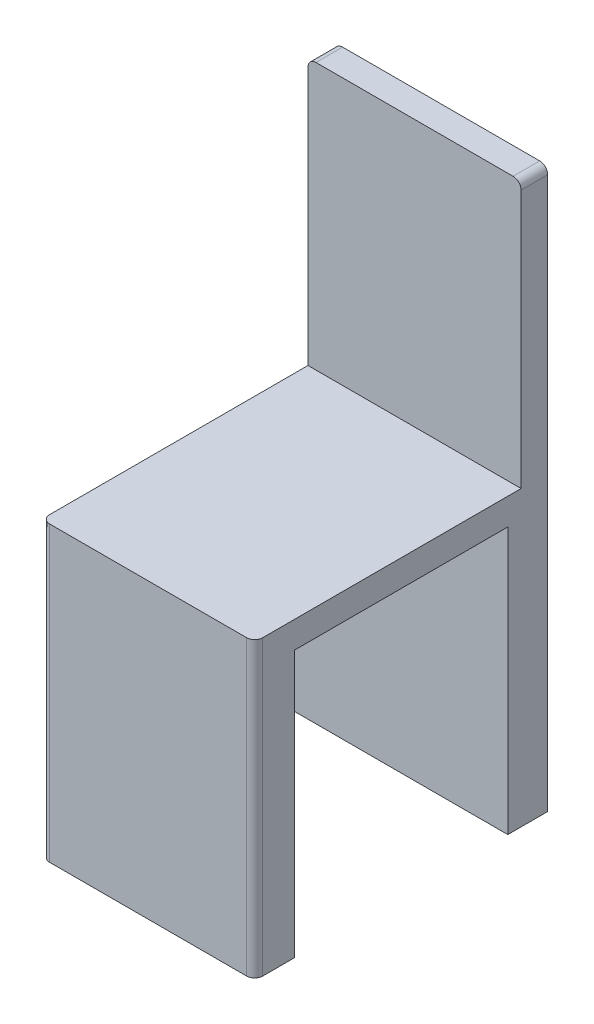
from build123d import *

# Parameters (mm, degrees)
SKETCH_1_W      = 15
SKETCH_1_H      = 100
EXTRUDE_1_DEPTH = 80
FILLET_1_R      = 3
FILLET_2_R      = 3


with BuildPart() as part:
    # 스케치1 → 보스-돌출1 (new body)
    with BuildSketch(Plane(origin=(0, 0, 0), x_dir=(0, 0, -1), z_dir=(1, 0, 0))):
        Polygon((0, -10), (0, 0), (100, 0), (100, 100), (110, 100), (110, -10), align=None)
        with Locations((102.5, -60)):
            Rectangle(SKETCH_1_W, SKETCH_1_H)
        with Locations((7.5, -60)):
            Rectangle(SKETCH_1_W, SKETCH_1_H)
    extrude(amount=EXTRUDE_1_DEPTH)

    # 필렛1
    fillet_1_edges = [part.edges().sort_by_distance(p)[0] for p in [
        (0, 100, -105),
        (80, 100, -105),
    ]]
    fillet(fillet_1_edges, radius=FILLET_1_R)

    # 필렛2
    fillet_2_edges = [part.edges().sort_by_distance(p)[0] for p in [
        (0, -55, 0),
        (80, -55, 0),
    ]]
    fillet(fillet_2_edges, radius=FILLET_2_R)


solid = part.part
